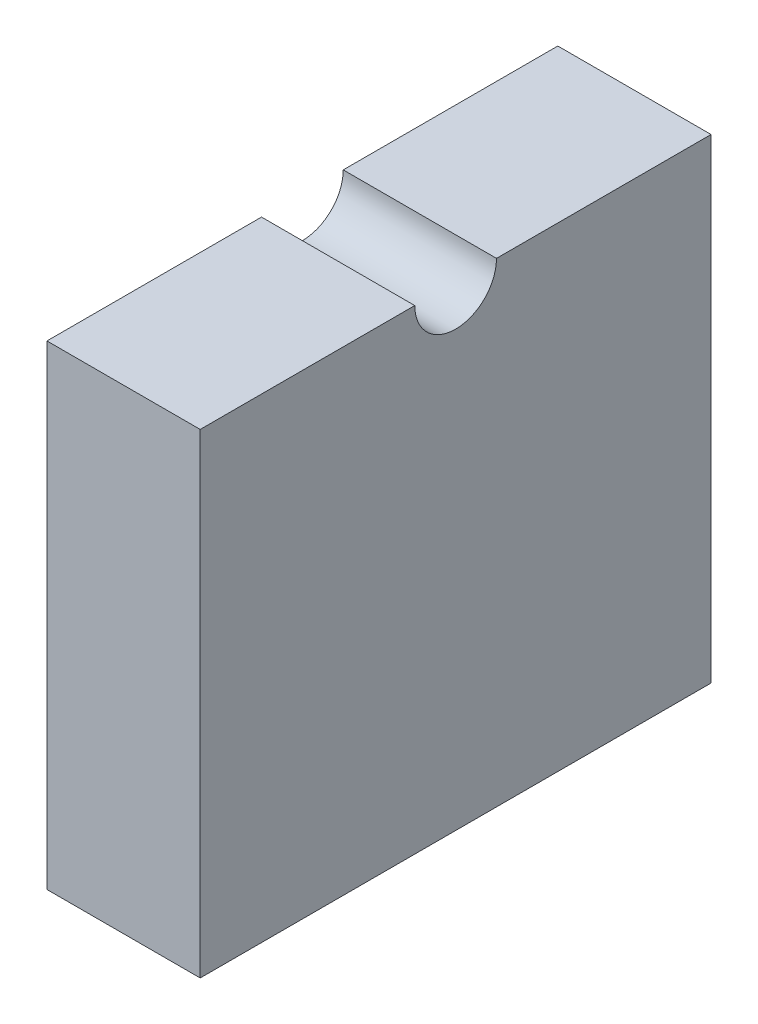
from build123d import *

# Parameters (mm, degrees)
SALIENTE_EXTRUIR1_DEPTH = 15


with BuildPart() as part:
    # Croquis1 → Saliente-Extruir1 (new body)
    with BuildSketch(Plane(origin=(0, 0, 0), x_dir=(0, 0, -1), z_dir=(1, 0, 0))):
        with BuildLine():
            Line((4, 23.25), (25, 23.25))
            Line((25, 23.25), (25, -23.25))
            Line((25, -23.25), (-25, -23.25))
            Line((-25, -23.25), (-25, 23.25))
            Line((-25, 23.25), (-4, 23.25))
            ThreePointArc((-4, 23.25), (0, 19.25), (4, 23.25))
        make_face()
    extrude(amount=SALIENTE_EXTRUIR1_DEPTH)


solid = part.part
